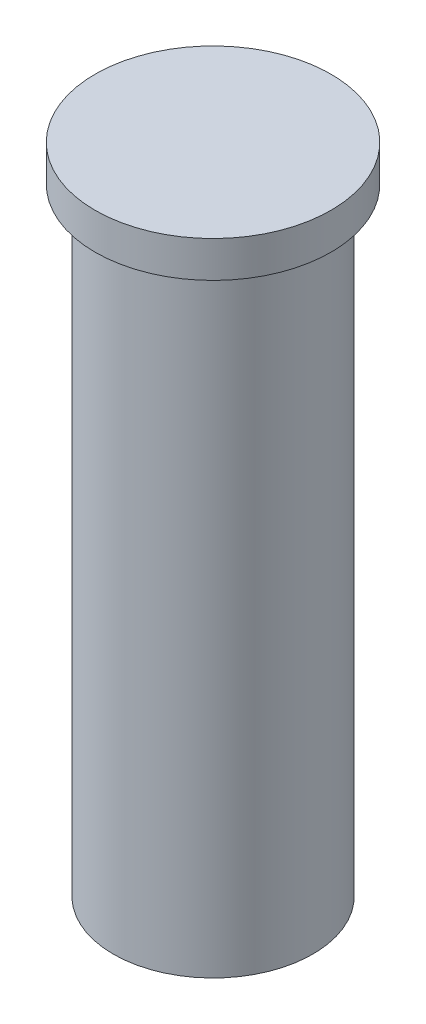
from build123d import *

# Parameters (mm, degrees)
SKETCH1_R           = 27.5
SKETCH1_R_2         = 22.5
BOSS_EXTRUDE1_DEPTH = 170
SKETCH2_R           = 32.5
BOSS_EXTRUDE2_DEPTH = 10


with BuildPart() as part:
    # Sketch1 → Boss-Extrude1 (new body)
    with BuildSketch(Plane(origin=(0, 0, 0), x_dir=(1, 0, 0), z_dir=(0, 1, 0))):
        with Locations(Location((0, 0, 0), (0, 0, 270))):
            Circle(SKETCH1_R)
        with Locations(Location((0, 0, 0), (0, 0, 270))):
            Circle(SKETCH1_R_2, mode=Mode.SUBTRACT)
    extrude(amount=BOSS_EXTRUDE1_DEPTH)

    # Sketch2 → Boss-Extrude2 (add)
    with BuildSketch(Plane(origin=(0, 170, 0), x_dir=(1, 0, 0), z_dir=(0, 1, 0))):
        with Locations(Location((0, 0, 0), (0, 0, 270))):
            Circle(SKETCH2_R)
    extrude(amount=BOSS_EXTRUDE2_DEPTH)


solid = part.part
